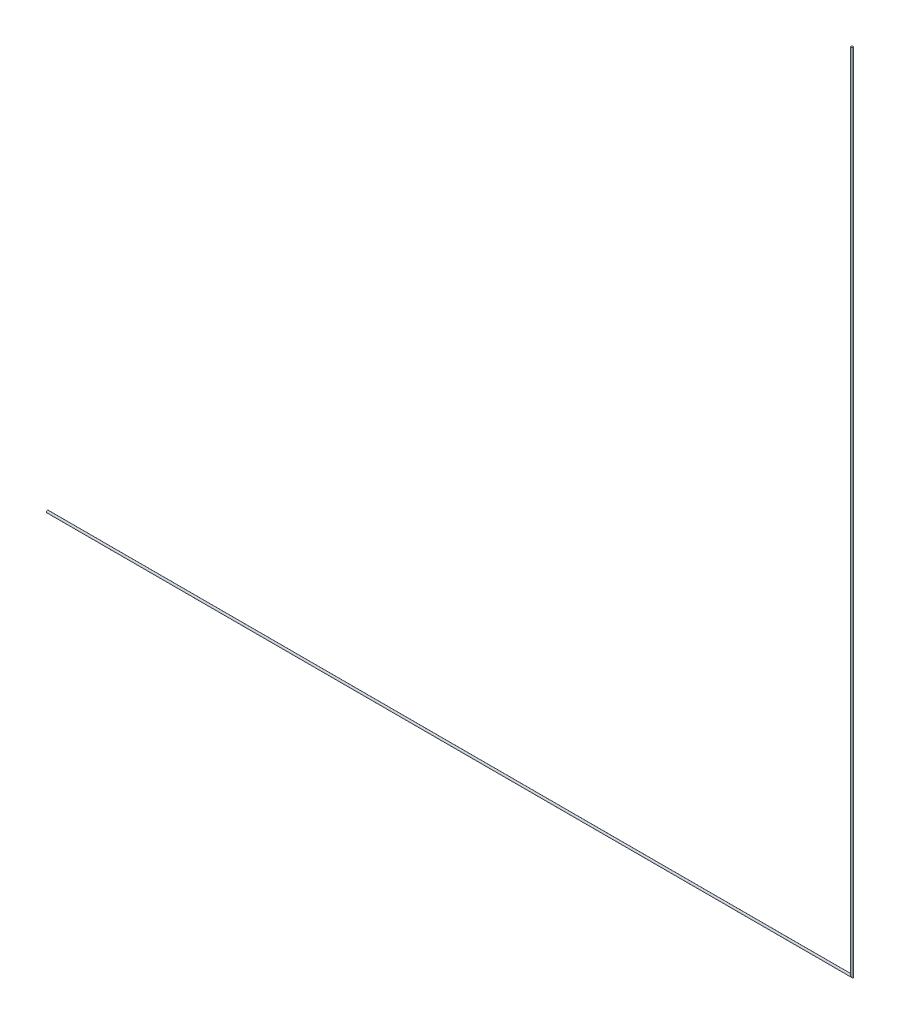
from build123d import *

# Parameters (mm, degrees)
SKETCH_3_R = 1


with BuildPart() as part:
    # ｽｲｰﾌﾟ1: sweep along a path in ｽｹｯﾁ1
    with BuildLine(Plane.XY) as sweep_1_path:
        Line((0, 0), (762, 0))
        Line((762, 0), (762, 762))
    # ｽｹｯﾁ3 → ｽｲｰﾌﾟ1 (sweep)
    with BuildSketch(Plane(origin=(0, 0, 0), x_dir=(0, 0, -1), z_dir=(1, 0, 0))):
        Circle(SKETCH_3_R)
    sweep(path=sweep_1_path.line, transition=Transition.RIGHT)


solid = part.part
